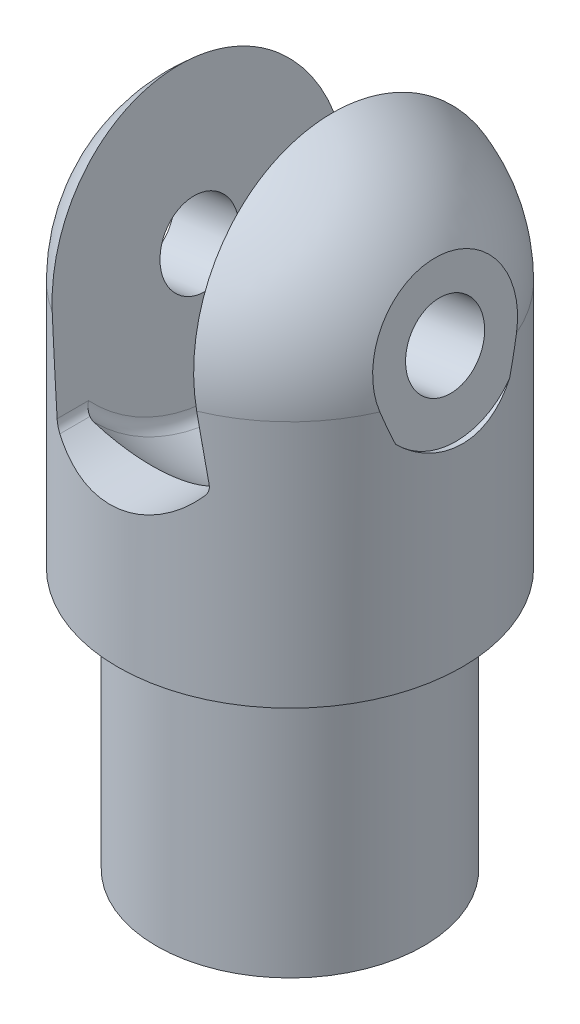
from build123d import *

# Parameters (mm, degrees)
SKETCH1_R                     = 12.9921
BOSS_EXTRUDE1_DEPTH           = 25.4
CUT_EXTRUDE1_DEPTH            = 103.48807232
CUT_EXTRUDE1_DEPTH_BACK       = 103.48807232
SKETCH3_R                     = 3.81
CUT_REVOLVE10_ANGLE           = 180
CUT_REVOLVE10_OTHER_WAY_ANGLE = 90
CUT_EXTRUDE4_DEPTH            = 32.004
FILLET1_R                     = 1.27
SKETCH15_R                    = 7.62
CUT_EXTRUDE5_DEPTH            = 10.16


with BuildPart() as part:
    # Sketch1 → Boss-Extrude1 (new body)
    with BuildSketch(Plane(origin=(0, 0, 0), x_dir=(1, 0, 0), z_dir=(0, 1, 0))):
        Circle(SKETCH1_R)
    extrude(amount=BOSS_EXTRUDE1_DEPTH)

    # Sketch2 → Revolve1 (revolve)
    with BuildSketch(Plane(origin=(0, 0, 0), x_dir=(0, 0, -1), z_dir=(1, 0, 0))):
        with BuildLine():
            Line((-16.764, 25.4), (-16.764, 49.53))
            ThreePointArc((-16.764, 49.53), (-11.85393808, 61.38393808), (0, 66.294))
            Line((0, 66.294), (0, 25.4))
            Line((0, 25.4), (-16.764, 25.4))
        make_face()
    revolve(axis=Axis((0, 25.4, 0), (0, 1, 0)))

    # Sketch3 → Cut-Extrude1 (cut, two sides: drawn at the far end of the back side and taken through both)
    with BuildSketch(Plane(origin=(-6.855604404, 98.310160002, 0), x_dir=(0, 0, -1), z_dir=(-0.9902680687415708, -0.1391731009600624, 0)).offset(-CUT_EXTRUDE1_DEPTH_BACK)):
        with Locations((0, 49.259550562)):
            Circle(SKETCH3_R)
    extrude(amount=CUT_EXTRUDE1_DEPTH + CUT_EXTRUDE1_DEPTH_BACK, mode=Mode.SUBTRACT)

    # Sketch11 → Cut-Revolve10 (revolve, cut)
    with BuildSketch(Plane.XY):
        with BuildLine():
            Line((-8.803483131, 48.292751132), (-11.047927713, 64.262804154))
            ThreePointArc((-11.047927713, 64.262804154), (-3.937784002, 67.51905451), (3.88252071, 67.531062689))
            Line((3.88252071, 67.531062689), (6.288202237, 50.413749191))
            Line((6.288202237, 50.413749191), (-8.803483131, 48.292751132))
        make_face()
    revolve(axis=Axis((17.272404581, 51.957478157, 0), (-0.9902680687415708, -0.1391731009600623, 0)), revolution_arc=CUT_REVOLVE10_ANGLE, mode=Mode.SUBTRACT)

    # Sketch11 → Cut-Revolve10 other way (revolve, cut)
    with BuildSketch(Plane.XY):
        with BuildLine():
            Line((-8.803483131, 48.292751132), (-11.047927713, 64.262804154))
            ThreePointArc((-11.047927713, 64.262804154), (-3.937784002, 67.51905451), (3.88252071, 67.531062689))
            Line((3.88252071, 67.531062689), (6.288202237, 50.413749191))
            Line((6.288202237, 50.413749191), (-8.803483131, 48.292751132))
        make_face()
    revolve(axis=Axis((17.272404581, 51.957478157, 0), (0.9902680687415708, 0.1391731009600623, 0)), revolution_arc=CUT_REVOLVE10_OTHER_WAY_ANGLE, mode=Mode.SUBTRACT)

    # Sketch13 → Cut-Revolve11 (revolve, cut)
    with BuildSketch(Plane.XY):
        with BuildLine():
            Line((-9.333732646, 52.065672474), (5.757952722, 54.186670533))
            Line((5.757952722, 54.186670533), (3.424787908, 70.78800081))
            ThreePointArc((3.424787908, 70.78800081), (-4.350762616, 71.36195799), (-11.66689746, 68.667002751))
            Line((-11.66689746, 68.667002751), (-9.333732646, 52.065672474))
        make_face()
    revolve(axis=Axis((-9.333732646, 52.065672474, 0), (0.9902680687415707, 0.13917310096006275, 0)), mode=Mode.SUBTRACT)

    # Sketch14 → Cut-Extrude4 (cut)
    with BuildSketch(Plane.XY):
        with BuildLine():
            Line((-8.803483131, 48.292751132), (-7.764410533, 40.899365431))
            ThreePointArc((-7.764410533, 40.899365431), (0.227058194, 38.789070404), (7.327274834, 43.020363489))
            Line((7.327274834, 43.020363489), (6.288202237, 50.413749191))
            Line((6.288202237, 50.413749191), (-8.803483131, 48.292751132))
        make_face()
    extrude(amount=CUT_EXTRUDE4_DEPTH, mode=Mode.SUBTRACT)

    # Fillet1
    fillet1_edges = [part.edges().sort_by_distance(p)[0] for p in [
        (-6.92582295, 34.932504728, -8.835062719),
        (-6.77980319, 33.893520154, 0),
        (-7.200056805, 36.883780001, 6.782727573),
        (-7.764410533, 40.899365431, 13.631549898),
        (7.327274834, 43.020363489, 13.74173908),
        (7.891628562, 39.00477806, 6.782727573),
        (8.39250065, 35.440887975, 0),
        (8.369397705, 35.60527397, -8.669914189),
    ]]
    fillet(fillet1_edges, radius=FILLET1_R)

    # Sketch15 → Cut-Extrude5 (cut)
    with BuildSketch(Plane(origin=(-8.265526251, -1.161643959, 0), x_dir=(0, 0, -1), z_dir=(-0.9902680687415708, -0.1391731009600624, 0))):
        with Locations((0, -49.047977445)):
            Circle(SKETCH15_R)
    cut_extrude5 = extrude(amount=CUT_EXTRUDE5_DEPTH, mode=Mode.SUBTRACT)

    # Mirror1: Cut-Extrude5 across plane
    add(cut_extrude5.mirror(Plane(origin=(6.826159117, 0.9593541, 0), x_dir=(0, 0, 1), z_dir=(-0.9902680687415707, -0.13917310096006238, 0))), mode=Mode.SUBTRACT)


solid = part.part
